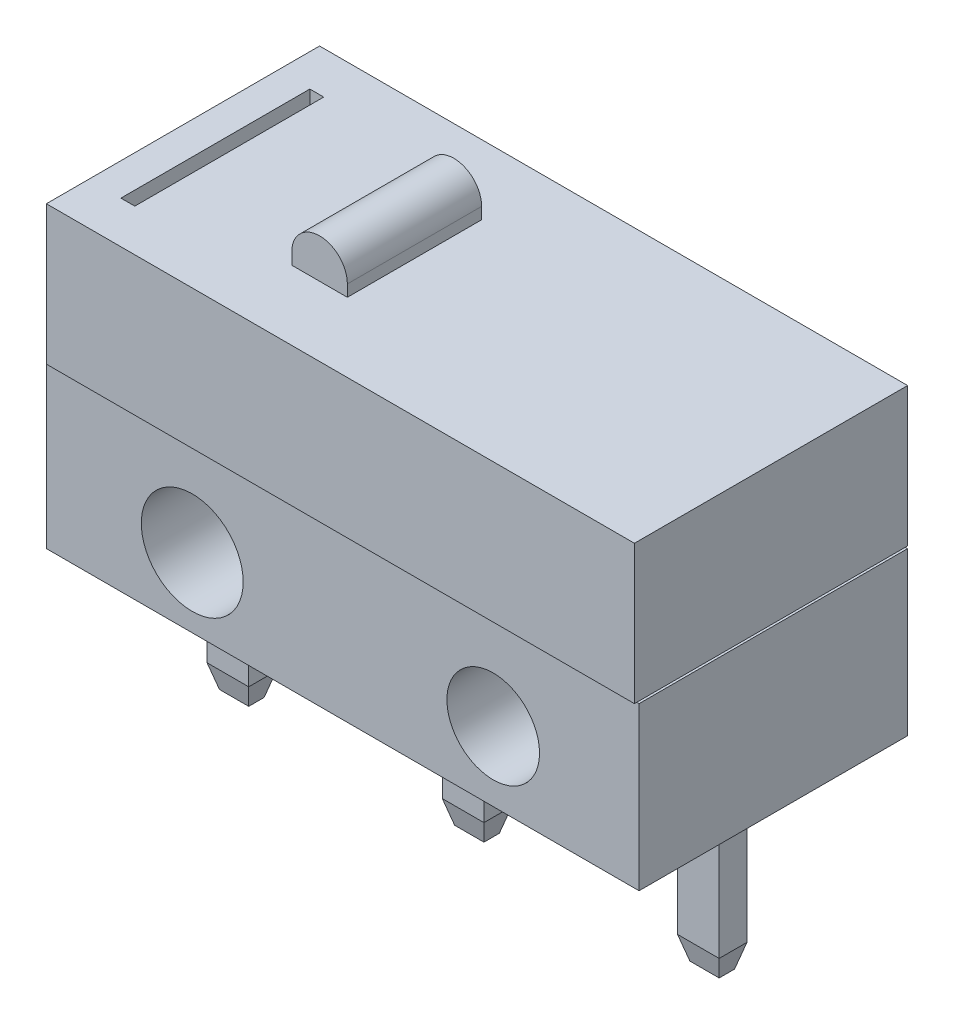
from build123d import *
from OCP.BRepFilletAPI import BRepFilletAPI_MakeChamfer

# Parameters (mm, degrees)
SKETCH1_W                = 12.8
SKETCH1_H                = 5.8
BOSS_EXTRUDE1_DEPTH      = 3.5
SKETCH2_W                = 0.9
SKETCH2_H                = 0.6
BOSS_EXTRUDE3_DEPTH      = 3.5
CHAMFER1_SIZE            = 0.5
CHAMFER1_SIZE2           = 0.133974596
SKETCH3_R                = 1.1
SKETCH3_R_2              = 1
CUT_EXTRUDE1_DEPTH       = 5.8
SKETCH4_W                = 12.7
SKETCH4_H                = 5.9
BOSS_EXTRUDE4_DEPTH      = 3
BOSS_EXTRUDE5_DEPTH      = 1.45
BOSS_EXTRUDE5_DEPTH_BACK = 1.45
SKETCH6_W                = 0.3
SKETCH6_H                = 4.08
CUT_EXTRUDE2_DEPTH       = 0.4


with BuildPart() as part:
    # Sketch1 → Boss-Extrude1 (new body)
    with BuildSketch(Plane(origin=(0, 0, 0), x_dir=(1, 0, 0), z_dir=(0, 1, 0))):
        Rectangle(SKETCH1_W, SKETCH1_H)
    extrude(amount=BOSS_EXTRUDE1_DEPTH)

    # Sketch2 → Boss-Extrude3 (add)
    with BuildSketch(Plane.XZ):
        Rectangle(SKETCH2_W, SKETCH2_H)
        with Locations((-5.08, 0)):
            Rectangle(SKETCH2_W, SKETCH2_H)
        with Locations((5.08, 0)):
            Rectangle(SKETCH2_W, SKETCH2_H)
    extrude(amount=BOSS_EXTRUDE3_DEPTH)

    # Chamfer1: one chamfer whose edges measure the first distance from different faces: ONE call of the kernel's chamfer builder (chamfer() names one face for all edges)
    chamfer1_edges_1 = [part.edges().sort_by_distance(p)[0] for p in [
        (0.45, -3.5, 0),
    ]]
    chamfer1_side_1 = [part.faces().sort_by_distance(p)[0] for p in [
        (0.45, -1.75, 0),
    ]]
    chamfer1_edges_2 = [part.edges().sort_by_distance(p)[0] for p in [
        (0, -3.5, 0.3),
    ]]
    chamfer1_side_2 = [part.faces().sort_by_distance(p)[0] for p in [
        (0, -1.75, 0.3),
    ]]
    chamfer1_edges_3 = [part.edges().sort_by_distance(p)[0] for p in [
        (-0.45, -3.5, 0),
    ]]
    chamfer1_side_3 = [part.faces().sort_by_distance(p)[0] for p in [
        (-0.45, -1.75, 0),
    ]]
    chamfer1_edges_4 = [part.edges().sort_by_distance(p)[0] for p in [
        (0, -3.5, -0.3),
    ]]
    chamfer1_side_4 = [part.faces().sort_by_distance(p)[0] for p in [
        (0, -1.75, -0.3),
    ]]
    chamfer1_edges_5 = [part.edges().sort_by_distance(p)[0] for p in [
        (-4.63, -3.5, 0),
    ]]
    chamfer1_side_5 = [part.faces().sort_by_distance(p)[0] for p in [
        (-4.63, -1.75, 0),
    ]]
    chamfer1_edges_6 = [part.edges().sort_by_distance(p)[0] for p in [
        (-5.08, -3.5, 0.3),
    ]]
    chamfer1_side_6 = [part.faces().sort_by_distance(p)[0] for p in [
        (-5.08, -1.75, 0.3),
    ]]
    chamfer1_edges_7 = [part.edges().sort_by_distance(p)[0] for p in [
        (-5.53, -3.5, 0),
    ]]
    chamfer1_side_7 = [part.faces().sort_by_distance(p)[0] for p in [
        (-5.53, -1.75, 0),
    ]]
    chamfer1_edges_8 = [part.edges().sort_by_distance(p)[0] for p in [
        (-5.08, -3.5, -0.3),
    ]]
    chamfer1_side_8 = [part.faces().sort_by_distance(p)[0] for p in [
        (-5.08, -1.75, -0.3),
    ]]
    chamfer1_edges_9 = [part.edges().sort_by_distance(p)[0] for p in [
        (5.53, -3.5, 0),
    ]]
    chamfer1_side_9 = [part.faces().sort_by_distance(p)[0] for p in [
        (5.53, -1.75, 0),
    ]]
    chamfer1_edges_10 = [part.edges().sort_by_distance(p)[0] for p in [
        (5.08, -3.5, 0.3),
    ]]
    chamfer1_side_10 = [part.faces().sort_by_distance(p)[0] for p in [
        (5.08, -1.75, 0.3),
    ]]
    chamfer1_edges_11 = [part.edges().sort_by_distance(p)[0] for p in [
        (4.63, -3.5, 0),
    ]]
    chamfer1_side_11 = [part.faces().sort_by_distance(p)[0] for p in [
        (4.63, -1.75, 0),
    ]]
    chamfer1_edges_12 = [part.edges().sort_by_distance(p)[0] for p in [
        (5.08, -3.5, -0.3),
    ]]
    chamfer1_side_12 = [part.faces().sort_by_distance(p)[0] for p in [
        (5.08, -1.75, -0.3),
    ]]
    chamfer1 = BRepFilletAPI_MakeChamfer(part.part.solid().wrapped)
    for e in chamfer1_edges_1:
        chamfer1.Add(CHAMFER1_SIZE, CHAMFER1_SIZE2, e.wrapped, chamfer1_side_1[0].wrapped)  # the first distance lies on this face
    for e in chamfer1_edges_2:
        chamfer1.Add(CHAMFER1_SIZE, CHAMFER1_SIZE2, e.wrapped, chamfer1_side_2[0].wrapped)  # the first distance lies on this face
    for e in chamfer1_edges_3:
        chamfer1.Add(CHAMFER1_SIZE, CHAMFER1_SIZE2, e.wrapped, chamfer1_side_3[0].wrapped)  # the first distance lies on this face
    for e in chamfer1_edges_4:
        chamfer1.Add(CHAMFER1_SIZE, CHAMFER1_SIZE2, e.wrapped, chamfer1_side_4[0].wrapped)  # the first distance lies on this face
    for e in chamfer1_edges_5:
        chamfer1.Add(CHAMFER1_SIZE, CHAMFER1_SIZE2, e.wrapped, chamfer1_side_5[0].wrapped)  # the first distance lies on this face
    for e in chamfer1_edges_6:
        chamfer1.Add(CHAMFER1_SIZE, CHAMFER1_SIZE2, e.wrapped, chamfer1_side_6[0].wrapped)  # the first distance lies on this face
    for e in chamfer1_edges_7:
        chamfer1.Add(CHAMFER1_SIZE, CHAMFER1_SIZE2, e.wrapped, chamfer1_side_7[0].wrapped)  # the first distance lies on this face
    for e in chamfer1_edges_8:
        chamfer1.Add(CHAMFER1_SIZE, CHAMFER1_SIZE2, e.wrapped, chamfer1_side_8[0].wrapped)  # the first distance lies on this face
    for e in chamfer1_edges_9:
        chamfer1.Add(CHAMFER1_SIZE, CHAMFER1_SIZE2, e.wrapped, chamfer1_side_9[0].wrapped)  # the first distance lies on this face
    for e in chamfer1_edges_10:
        chamfer1.Add(CHAMFER1_SIZE, CHAMFER1_SIZE2, e.wrapped, chamfer1_side_10[0].wrapped)  # the first distance lies on this face
    for e in chamfer1_edges_11:
        chamfer1.Add(CHAMFER1_SIZE, CHAMFER1_SIZE2, e.wrapped, chamfer1_side_11[0].wrapped)  # the first distance lies on this face
    for e in chamfer1_edges_12:
        chamfer1.Add(CHAMFER1_SIZE, CHAMFER1_SIZE2, e.wrapped, chamfer1_side_12[0].wrapped)  # the first distance lies on this face
    add(Compound.cast(chamfer1.Shape()), mode=Mode.REPLACE)

    # Sketch3 → Cut-Extrude1 (cut)
    with BuildSketch(Plane.XY.offset(2.9)):
        with Locations((-3.25, 1.5)):
            Circle(SKETCH3_R)
        with Locations((3.25, 1.5)):
            Circle(SKETCH3_R_2)
    extrude(amount=-CUT_EXTRUDE1_DEPTH, mode=Mode.SUBTRACT)

    # Sketch4 → Boss-Extrude4 (add)
    with BuildSketch(Plane(origin=(0, 3.5, 0), x_dir=(1, 0, 0), z_dir=(0, 1, 0))):
        Rectangle(SKETCH4_W, SKETCH4_H)
    extrude(amount=BOSS_EXTRUDE4_DEPTH)

    # Sketch5 → Boss-Extrude5 (add, two sides: drawn at the far end of the back side and taken through both)
    with BuildSketch(Plane.XY.offset(-BOSS_EXTRUDE5_DEPTH_BACK)):
        with BuildLine():
            Line((-2.55, 6.5), (-2.55, 6.75))
            ThreePointArc((-2.55, 6.75), (-1.95, 7.35), (-1.35, 6.75))
            Line((-1.35, 6.75), (-1.35, 6.5))
            Line((-1.35, 6.5), (-2.55, 6.5))
        make_face()
    extrude(amount=BOSS_EXTRUDE5_DEPTH + BOSS_EXTRUDE5_DEPTH_BACK)

    # Sketch6 → Cut-Extrude2 (cut)
    with BuildSketch(Plane(origin=(0, 6.5, 0), x_dir=(1, 0, 0), z_dir=(0, 1, 0))):
        with Locations((-5.5, 0)):
            Rectangle(SKETCH6_W, SKETCH6_H)
    extrude(amount=-CUT_EXTRUDE2_DEPTH, mode=Mode.SUBTRACT)


solid = part.part
